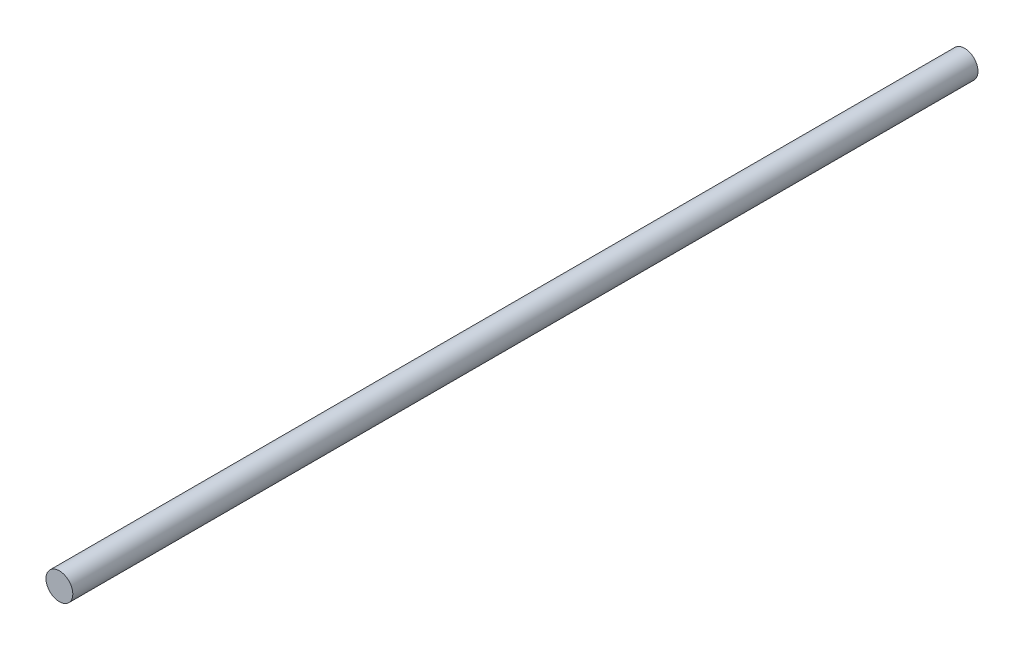
from build123d import *

# Parameters (mm, degrees)
SKETCH1_R           = 2
BOSS_EXTRUDE1_DEPTH = 135


with BuildPart() as part:
    # Sketch1 → Boss-Extrude1 (new body)
    with BuildSketch(Plane.XY):
        Circle(SKETCH1_R)
    extrude(amount=BOSS_EXTRUDE1_DEPTH)


solid = part.part
